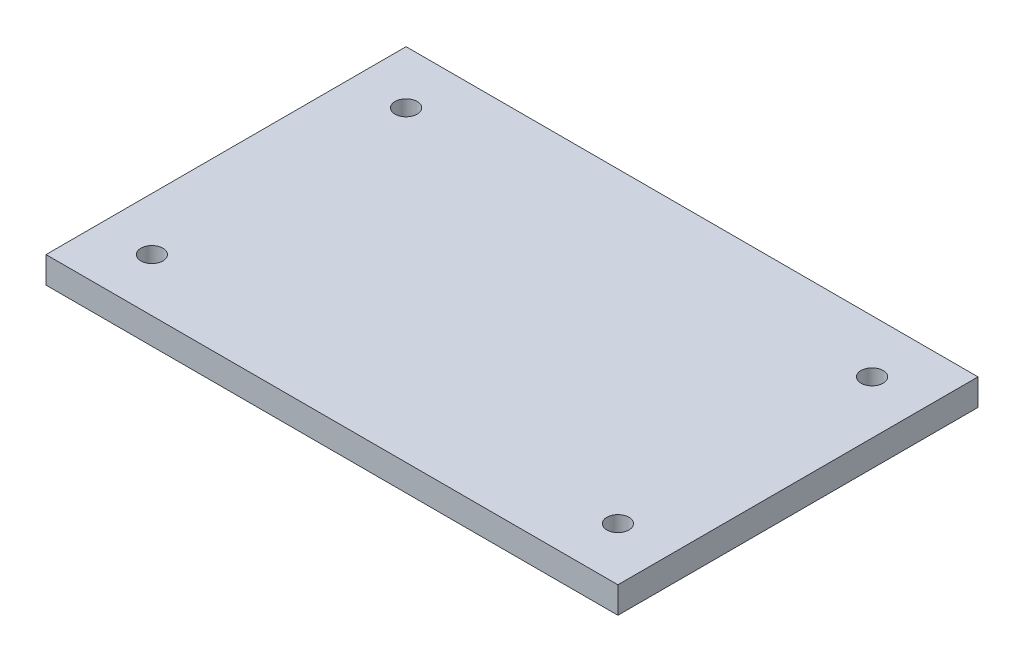
from build123d import *

# Parameters (mm, degrees)
SKETCH1_W            = 137.16
SKETCH1_H            = 86.36
BOSS_EXTRUDE1_DEPTH  = 6.35
M5_CLEARANCE_HOLE1_D = 5.3


with BuildPart() as part:
    # Sketch1 → Boss-Extrude1 (new body)
    with BuildSketch(Plane(origin=(0, 0, 0), x_dir=(1, 0, 0), z_dir=(0, 1, 0))):
        with Locations((76.2, 50.8)):
            Rectangle(SKETCH1_W, SKETCH1_H)
    extrude(amount=BOSS_EXTRUDE1_DEPTH)

    # M5 Clearance Hole1 (through all)
    with Locations(Plane(origin=(0, 6.35, 0), x_dir=(1, 0, 0), z_dir=(0, 1, 0))):
        with Locations((20.32, 81.28), (132.08, 81.28), (132.08, 20.32), (20.32, 20.32)):
            Hole(M5_CLEARANCE_HOLE1_D / 2)


solid = part.part
